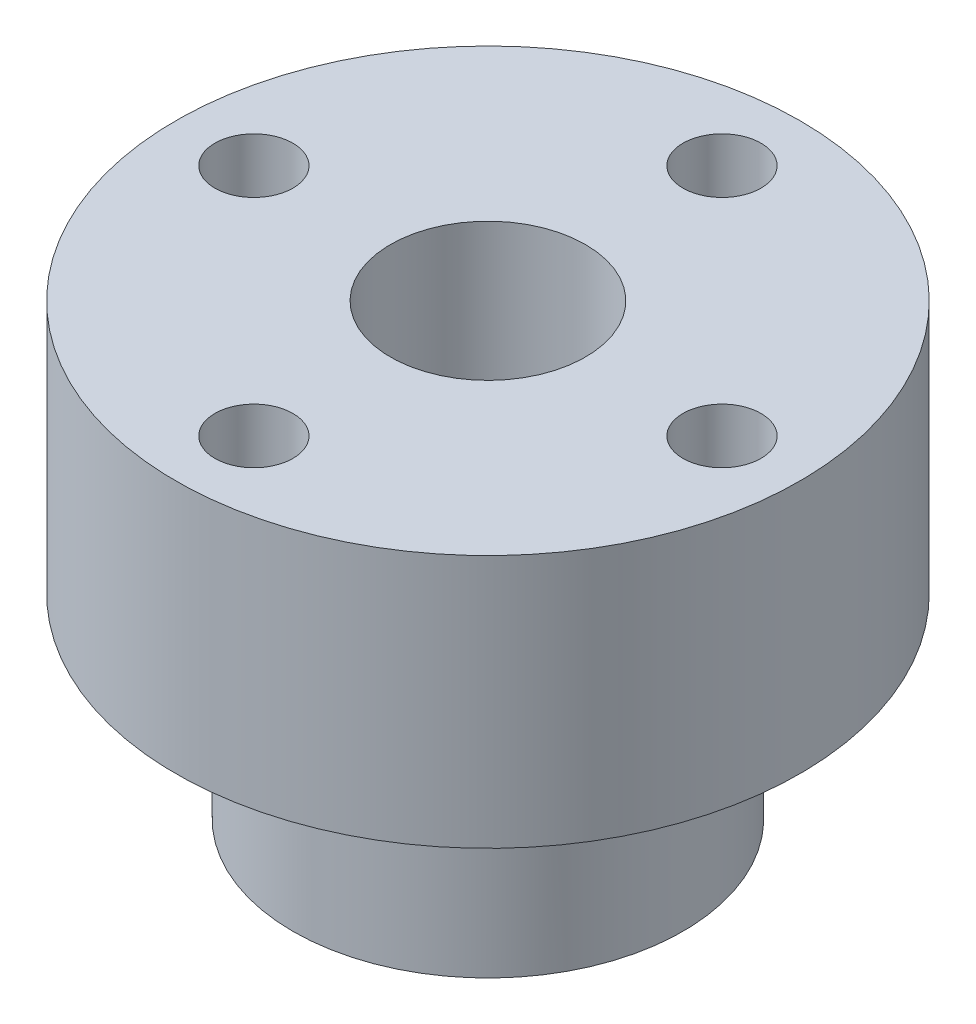
from build123d import *

# Parameters (mm, degrees)
SKETCH_1_R      = 16
SKETCH_1_R_2    = 2
SKETCH_1_R_3    = 5
EXTRUDE_1_DEPTH = 13
EXTRUDE_START   = -10
SKETCH_1_3_R    = 5
EXTRUDE_2_DEPTH = 10


with BuildPart() as part:
    # 草图1 → 凸台-拉伸1 (new body)
    with BuildSketch(Plane(origin=(0, 0, 0), x_dir=(1, 0, 0), z_dir=(0, 1, 0))):
        Circle(SKETCH_1_R)
        with Locations((0, -12)):
            Circle(SKETCH_1_R_2, mode=Mode.SUBTRACT)
        with Locations((-12, 0)):
            Circle(SKETCH_1_R_2, mode=Mode.SUBTRACT)
        with Locations((12, 0)):
            Circle(SKETCH_1_R_2, mode=Mode.SUBTRACT)
        with Locations((0, 12)):
            Circle(SKETCH_1_R_2, mode=Mode.SUBTRACT)
        Circle(SKETCH_1_R_3, mode=Mode.SUBTRACT)
    extrude(amount=EXTRUDE_1_DEPTH)

    # 草图1<3> → 凸台-拉伸2 (add)
    with BuildSketch(Plane(origin=(0, 0, 0), x_dir=(1, 0, 0), z_dir=(0, 1, 0)).offset(EXTRUDE_START)):
        with BuildLine():
            ThreePointArc((10, 0), (7.071067809, 7.071067815), (-9e-09, 10))
            ThreePointArc((-9e-09, 10), (-7.071067815, 7.071067809), (-10, 0))
            ThreePointArc((-10, 0), (-7.071067813, -7.071067811), (-2e-09, -10))
            ThreePointArc((-2e-09, -10), (7.071067811, -7.071067813), (10, 0))
        make_face()
        Circle(SKETCH_1_3_R, mode=Mode.SUBTRACT)
    extrude(amount=EXTRUDE_2_DEPTH)


solid = part.part
